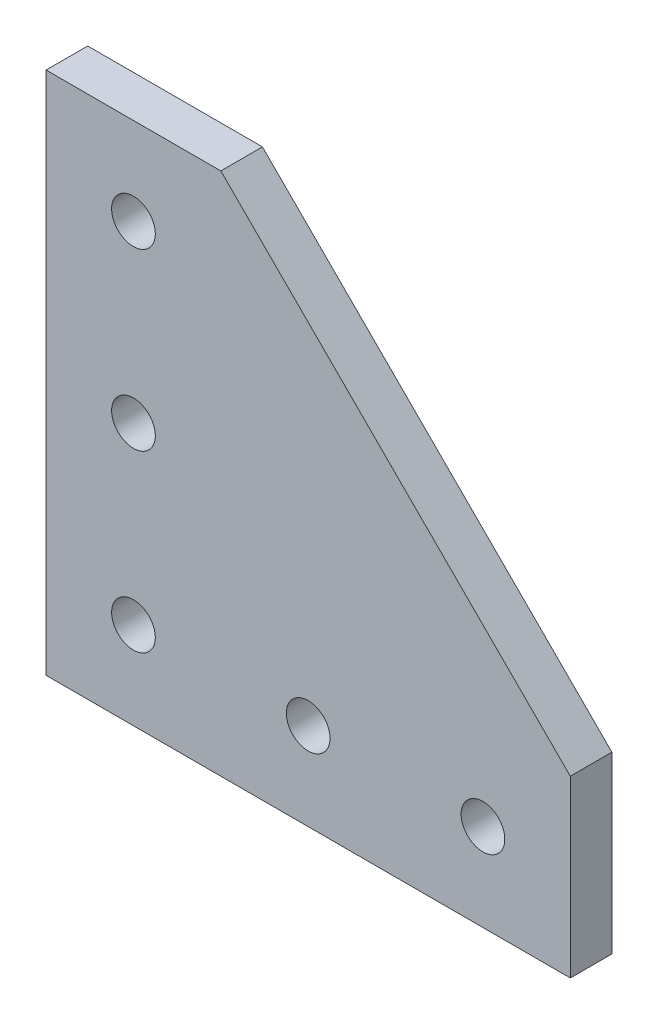
from build123d import *

# Parameters (mm, degrees)
SKETCH1_R           = 2.5
BOSS_EXTRUDE1_DEPTH = 4.7625


with BuildPart() as part:
    # Sketch1 → Boss-Extrude1 (new body)
    with BuildSketch(Plane.XY):
        Polygon((0, 0), (0, 60), (20, 60), (60, 20), (60, 0), align=None)
        with Locations(Location((10, 10, 0), (0, 0, 180))):
            Circle(SKETCH1_R, mode=Mode.SUBTRACT)
        with Locations(Location((30, 10, 0), (0, 0, 180))):
            Circle(SKETCH1_R, mode=Mode.SUBTRACT)
        with Locations(Location((50, 10, 0), (0, 0, 180))):
            Circle(SKETCH1_R, mode=Mode.SUBTRACT)
        with Locations(Location((10, 30, 0), (0, 0, 180))):
            Circle(SKETCH1_R, mode=Mode.SUBTRACT)
        with Locations(Location((10, 50, 0), (0, 0, 180))):
            Circle(SKETCH1_R, mode=Mode.SUBTRACT)
    extrude(amount=BOSS_EXTRUDE1_DEPTH)


solid = part.part
